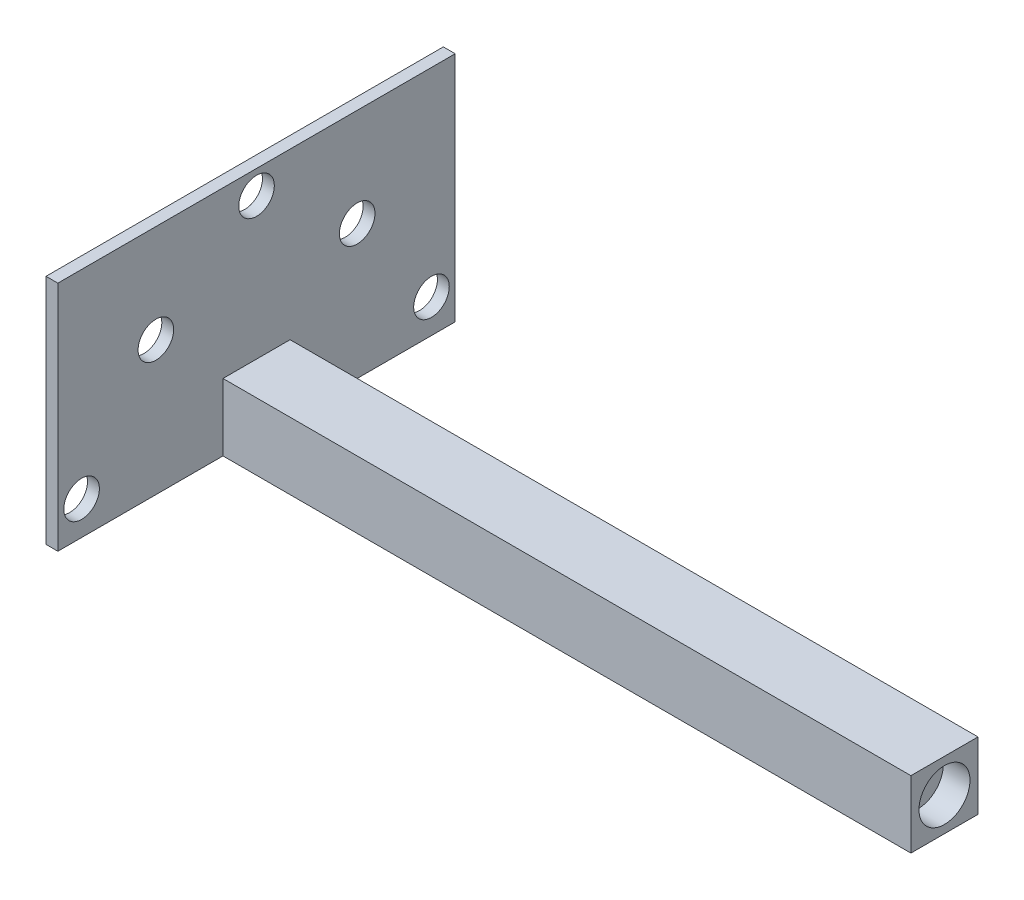
from build123d import *

# Parameters (mm, degrees)
SKETCH1_W           = 33.5
SKETCH1_H           = 19.578427125
SKETCH1_R           = 1.5
BOSS_EXTRUDE1_DEPTH = 1
SKETCH1_3_W         = 5.65685425
SKETCH1_3_H         = 5.65685425
BOSS_EXTRUDE2_DEPTH = 59
SKETCH3_R           = 2.15
CUT_EXTRUDE1_DEPTH  = 2.25


with BuildPart() as part:
    # Sketch1 → Boss-Extrude1 (new body)
    with BuildSketch(Plane(origin=(0, 0, 0), x_dir=(0, 0, -1), z_dir=(1, 0, 0))):
        with Locations((0, 6.960786437)):
            Rectangle(SKETCH1_W, SKETCH1_H)
        with Locations((-14.75, 0)):
            Circle(SKETCH1_R, mode=Mode.SUBTRACT)
        with Locations((14.75, 0)):
            Circle(SKETCH1_R, mode=Mode.SUBTRACT)
        with Locations((-8.485281374, 8.485281374)):
            Circle(SKETCH1_R, mode=Mode.SUBTRACT)
        with Locations((8.485281374, 8.485281374)):
            Circle(SKETCH1_R, mode=Mode.SUBTRACT)
        with Locations((0, 14.75)):
            Circle(SKETCH1_R, mode=Mode.SUBTRACT)
    extrude(amount=BOSS_EXTRUDE1_DEPTH)

    # Sketch1<3> → Boss-Extrude2 (add)
    with BuildSketch(Plane(origin=(0, 0, 0), x_dir=(0, 0, -1), z_dir=(1, 0, 0))):
        Rectangle(SKETCH1_3_W, SKETCH1_3_H)
    extrude(amount=BOSS_EXTRUDE2_DEPTH)

    # Sketch3 → Cut-Extrude1 (cut)
    with BuildSketch(Plane(origin=(59, 0, 0), x_dir=(0, 0, -1), z_dir=(1, 0, 0))):
        Circle(SKETCH3_R)
    extrude(amount=-CUT_EXTRUDE1_DEPTH, mode=Mode.SUBTRACT)


solid = part.part
